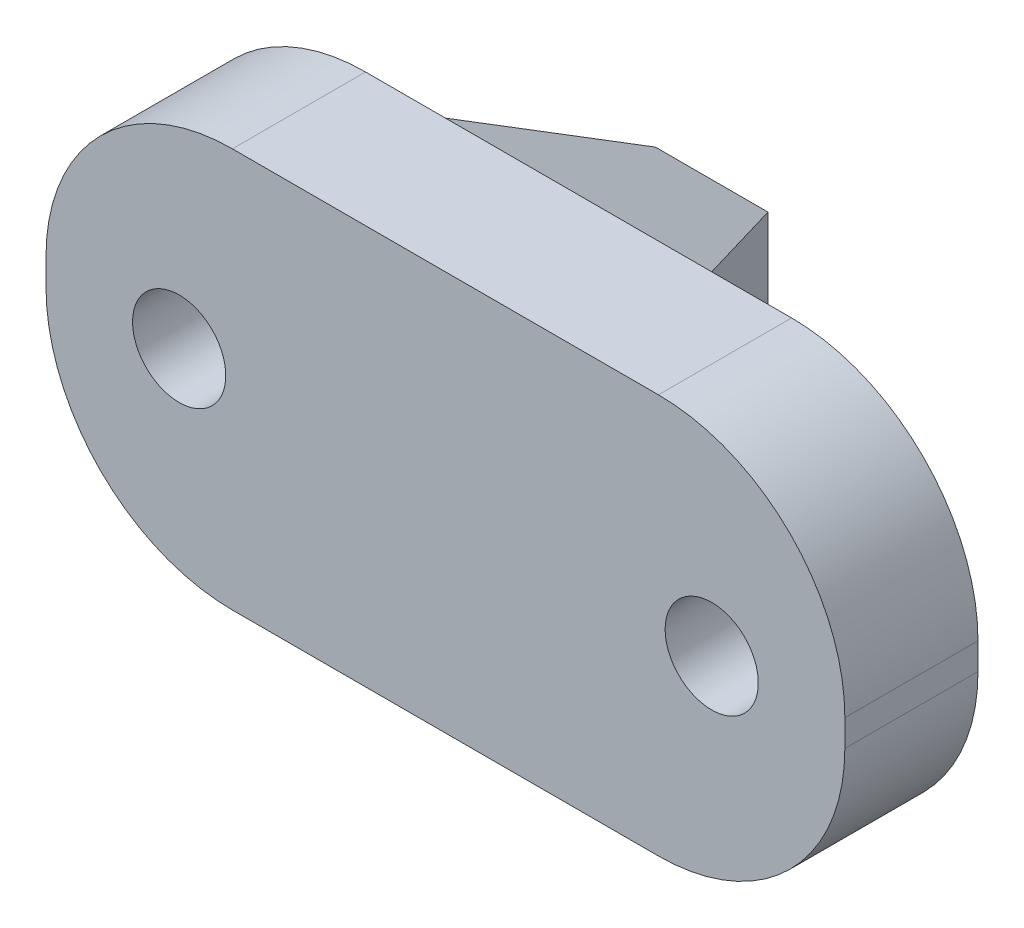
from build123d import *

# Parameters (mm, degrees)
BOSS_EXTRUDE1_DEPTH = 15
SKETCH11_R          = 1.75
CUT_EXTRUDE1_DEPTH  = 15
SKETCH12_R          = 3
CUT_EXTRUDE2_DEPTH  = 2
CHAMFER1_SIZE       = 2
CHAMFER1_SIZE2      = 5
CHAMFER2_SIZE       = 5
CHAMFER2_SIZE2      = 2
SKETCH13_W          = 3
SKETCH13_H          = 5
CUT_EXTRUDE3_DEPTH  = 36
FILLET1_R           = 7


with BuildPart() as part:
    # Sketch1 → Boss-Extrude1 (new body)
    with BuildSketch(Plane(origin=(0, 0, 0), x_dir=(1, 0, 0), z_dir=(0, 1, 0))):
        Polygon((-15, 0), (15, 0), (15, 5), (5, 5), (2.113248654, 10), (-2.113248654, 10), (-5, 5), (-15, 5), align=None)
    extrude(amount=BOSS_EXTRUDE1_DEPTH)

    # Sketch11 → Cut-Extrude1 (cut)
    with BuildSketch(Plane(origin=(0, 0, -5), x_dir=(-1, 0, 0), z_dir=(0, 0, -1))):
        with Locations((-10, 7.5)):
            Circle(SKETCH11_R)
        with Locations((10, 7.5)):
            Circle(SKETCH11_R)
    extrude(amount=-CUT_EXTRUDE1_DEPTH, mode=Mode.SUBTRACT)

    # Sketch12 → Cut-Extrude2 (cut)
    with BuildSketch(Plane(origin=(0, 0, -5), x_dir=(-1, 0, 0), z_dir=(0, 0, -1))):
        with Locations((-10, 7.5)):
            Circle(SKETCH12_R)
        with Locations((10, 7.5)):
            Circle(SKETCH12_R)
    extrude(amount=-CUT_EXTRUDE2_DEPTH, mode=Mode.SUBTRACT)

    # Chamfer1
    chamfer1_edges = [part.edges().sort_by_distance(p)[0] for p in [
        (0, 15, -10),
    ]]
    chamfer1_side = [part.faces().sort_by_distance(p)[0] for p in [
        (0, 7.5, -10),
    ]]
    chamfer(chamfer1_edges, length=CHAMFER1_SIZE, length2=CHAMFER1_SIZE2, reference=chamfer1_side[0])

    # Chamfer2
    chamfer2_edges = [part.edges().sort_by_distance(p)[0] for p in [
        (0, 0, -10),
    ]]
    chamfer2_side = [part.faces().sort_by_distance(p)[0] for p in [
        (0, 0, -3.3934981),
    ]]
    chamfer(chamfer2_edges, length=CHAMFER2_SIZE, length2=CHAMFER2_SIZE2, reference=chamfer2_side[0])

    # Sketch13 → Cut-Extrude3 (cut, through all)
    with BuildSketch(Plane(origin=(15, 0, 0), x_dir=(0, 0, -1), z_dir=(1, 0, 0))):
        with Locations((6.5, 7.5)):
            Rectangle(SKETCH13_W, SKETCH13_H)
    extrude(amount=-CUT_EXTRUDE3_DEPTH, mode=Mode.SUBTRACT)

    # Fillet1
    fillet1_edges = [part.edges().sort_by_distance(p)[0] for p in [
        (15, 15, -2.5),
        (-15, 0, -2.5),
        (-15, 15, -2.5),
        (15, 0, -2.5),
    ]]
    fillet(fillet1_edges, radius=FILLET1_R)


solid = part.part
